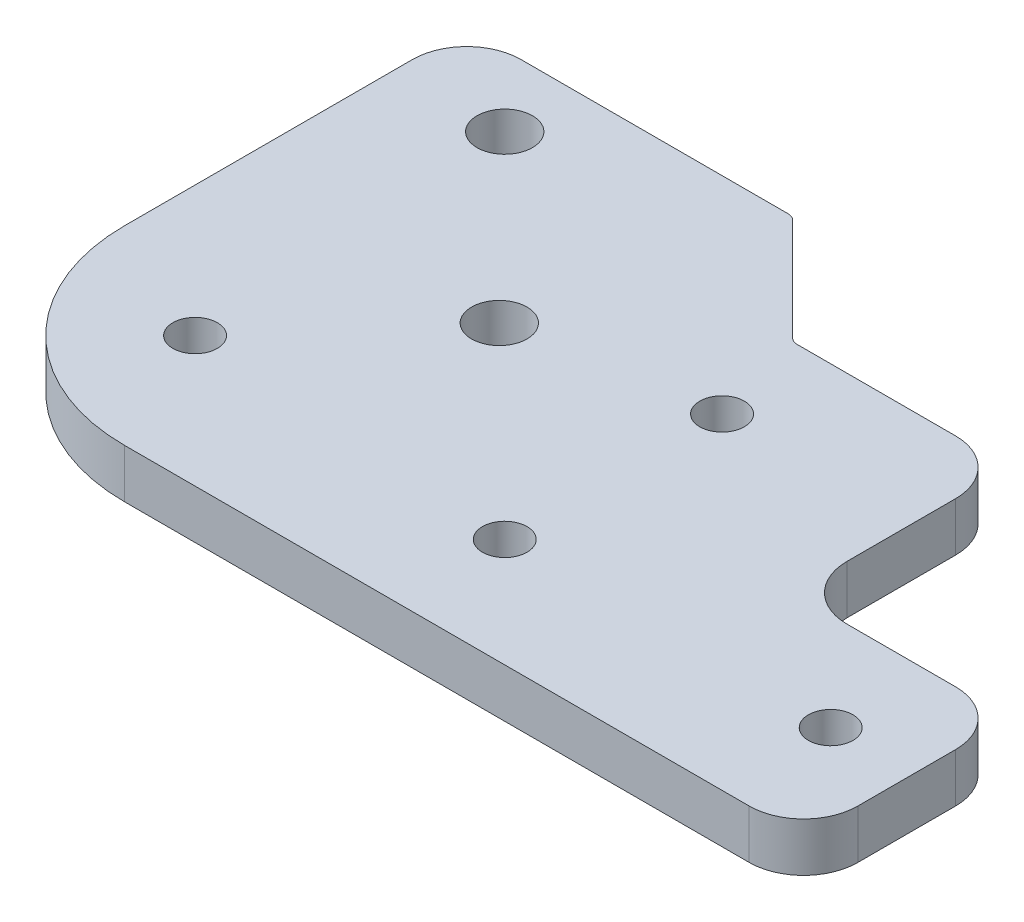
from build123d import *

# Parameters (mm, degrees)
SKETCH1_R           = 2.05
BOSS_EXTRUDE1_DEPTH = 4.5
SKETCH2_R           = 2.55
SKETCH2_R_2         = 2.05
CUT_EXTRUDE1_DEPTH  = 94.921509783
FILLET1_R           = 5
FILLET2_R           = 17.5
FILLET3_R           = 1


with BuildPart() as part:
    # Sketch1 → Boss-Extrude1 (new body)
    with BuildSketch(Plane(origin=(0, 0, 0), x_dir=(1, 0, 0), z_dir=(0, 1, 0))):
        Polygon((80, 19), (60, 19), (60, 39), (40, 39), (30, 49), (0, 49), (0, 0), (80, 0), align=None)
        with Locations(Location((72.5, 10, 0), (0, 0, 270))):
            Circle(SKETCH1_R, mode=Mode.SUBTRACT)
        with Locations(Location((42.5, 10, 0), (0, 0, 270))):
            Circle(SKETCH1_R, mode=Mode.SUBTRACT)
        with Locations(Location((42.5, 30, 0), (0, 0, 270))):
            Circle(SKETCH1_R, mode=Mode.SUBTRACT)
    extrude(amount=BOSS_EXTRUDE1_DEPTH)

    # Sketch2 → Cut-Extrude1 (cut, through all)
    with BuildSketch(Plane(origin=(0, 4.5, 0), x_dir=(1, 0, 0), z_dir=(0, 1, 0))):
        with Locations(Location((25, 27, 0), (0, 0, 270))):
            Circle(SKETCH2_R)
        with Locations(Location((10, 42.5, 0), (0, 0, 270))):
            Circle(SKETCH2_R)
        with Locations(Location((12, 12, 0), (0, 0, 270))):
            Circle(SKETCH2_R_2)
    extrude(amount=-CUT_EXTRUDE1_DEPTH, mode=Mode.SUBTRACT)

    # Fillet1
    fillet1_edges = [part.edges().sort_by_distance(p)[0] for p in [
        (0, 2.25, -49),
        (60, 2.25, -39),
        (60, 2.25, -19),
        (80, 2.25, -19),
        (80, 2.25, 0),
    ]]
    fillet(fillet1_edges, radius=FILLET1_R)

    # Fillet2
    fillet2_edges = [part.edges().sort_by_distance(p)[0] for p in [
        (0, 2.25, 0),
    ]]
    fillet(fillet2_edges, radius=FILLET2_R)

    # Fillet3
    fillet3_edges = [part.edges().sort_by_distance(p)[0] for p in [
        (30, 2.25, -49),
        (40, 2.25, -39),
    ]]
    fillet(fillet3_edges, radius=FILLET3_R)


solid = part.part
